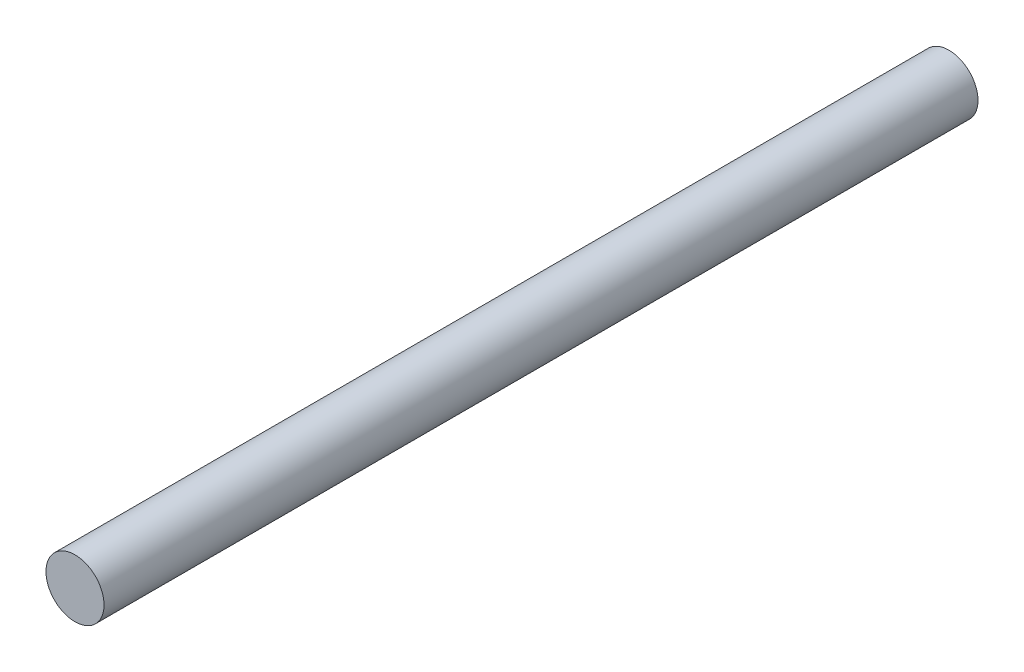
from build123d import *

# Parameters (mm, degrees)
SKETCH1_R           = 4
BOSS_EXTRUDE1_DEPTH = 120.4


with BuildPart() as part:
    # Sketch1 → Boss-Extrude1 (new body)
    with BuildSketch(Plane.XY):
        Circle(SKETCH1_R)
    extrude(amount=BOSS_EXTRUDE1_DEPTH)


solid = part.part
